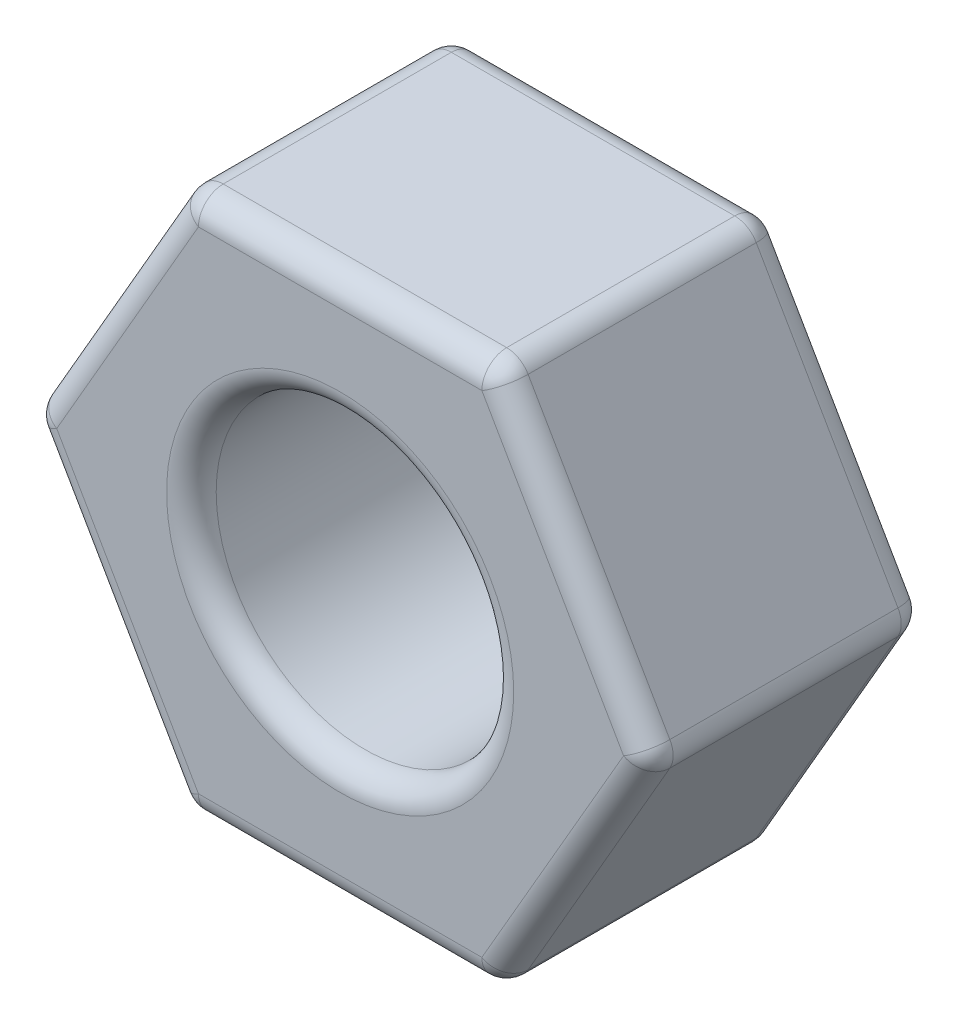
from build123d import *

# Parameters (mm, degrees)
ESBO_O1_R                = 3
RESSALTO_EXTRUS_O2_DEPTH = 5.6
FILETE1_R                = 0.5


with BuildPart() as part:
    # Esboço1 → Ressalto-extrusão2 (new body)
    with BuildSketch(Plane.XY):
        Polygon((-6.293117934, 0), (-3.146558967, -5.45), (3.146558967, -5.45), (6.293117934, 0), (3.146558967, 5.45), (-3.146558967, 5.45), align=None)
        Circle(ESBO_O1_R, mode=Mode.SUBTRACT)
    extrude(amount=RESSALTO_EXTRUS_O2_DEPTH)

    # Filete1
    filete1_edges = [part.edges().sort_by_distance(p)[0] for p in [
        (-3.146558967, 5.45, 2.8),
        (3.146558967, 5.45, 2.8),
        (6.293117934, 0, 2.8),
        (3.146558967, -5.45, 2.8),
        (-3.146558967, -5.45, 2.8),
        (-6.293117934, 0, 2.8),
        (0, -5.45, 5.6),
        (4.719838451, -2.725, 5.6),
        (-3, 0, 0),
        (-3, 0, 5.6),
        (4.719838451, 2.725, 5.6),
        (0, 5.45, 5.6),
        (-4.719838451, 2.725, 5.6),
        (0, 5.45, 0),
        (4.719838451, 2.725, 0),
        (4.719838451, -2.725, 0),
        (0, -5.45, 0),
        (-4.719838451, -2.725, 0),
        (-4.719838451, 2.725, 0),
        (-4.719838451, -2.725, 5.6),
    ]]
    fillet(filete1_edges, radius=FILETE1_R)


solid = part.part
